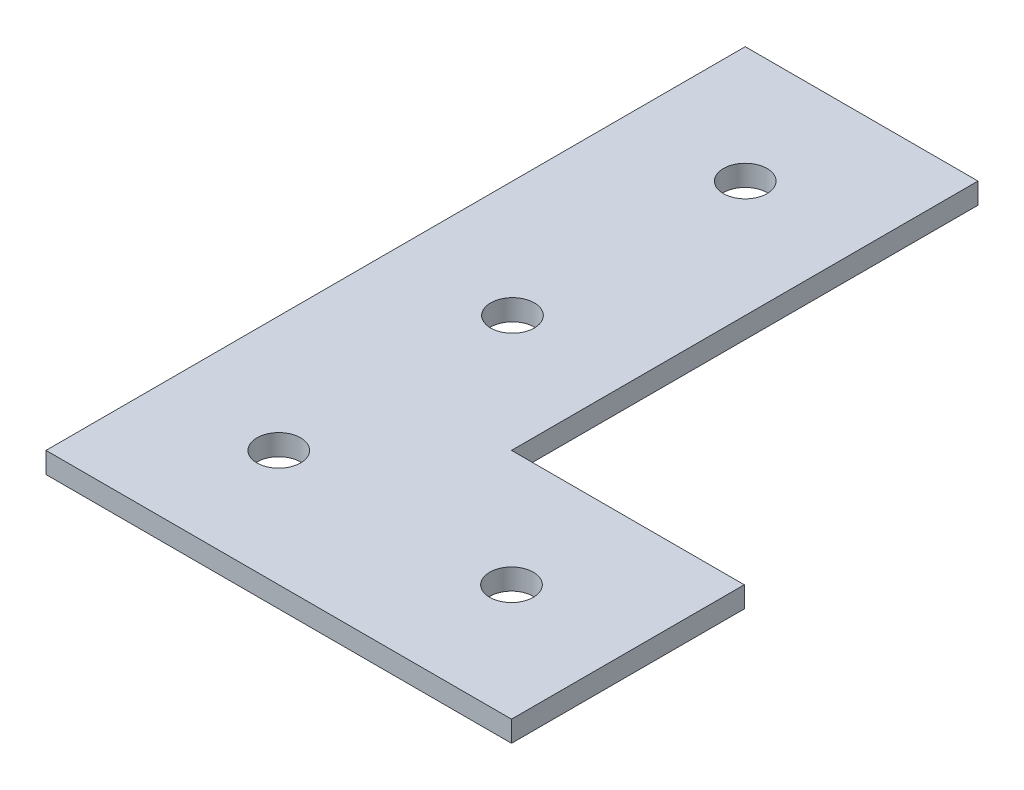
from build123d import *

# Parameters (mm, degrees)
BOSS_EXTRUDE1_DEPTH            = 2.286
F_3_16_0_1875_DIAMETER_HOLE1_D = 4.7625


with BuildPart() as part:
    # Sketch1 → Boss-Extrude1 (new body)
    with BuildSketch(Plane(origin=(0, 0, 0), x_dir=(1, 0, 0), z_dir=(0, 1, 0))):
        Polygon((-25.4, 76.30478401), (-25.4, 25.4), (0, 25.4), (0, 0), (-50.8, 0), (-50.8, 76.30478401), align=None)
    extrude(amount=BOSS_EXTRUDE1_DEPTH)

    # 3/16 (0.1875) Diameter Hole1 (through all)
    with Locations(Plane(origin=(0, 2.286, 0), x_dir=(1, 0, 0), z_dir=(0, 1, 0))):
        with Locations((-38.1, 63.60478401), (-38.1, 38.20478401), (-38.1, 12.7), (-12.7, 12.7)):
            Hole(F_3_16_0_1875_DIAMETER_HOLE1_D / 2)


solid = part.part
